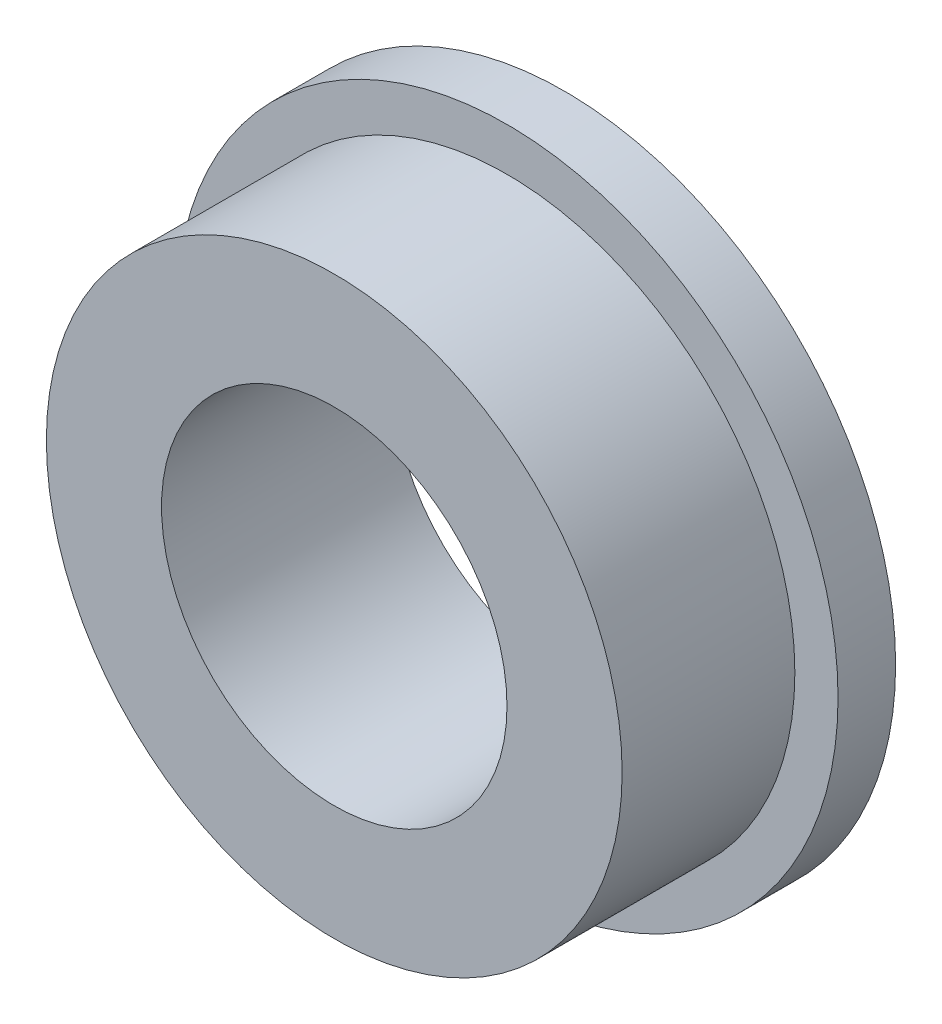
from build123d import *

# Parameters (mm, degrees)
SKETCH_1_R          = 5
SKETCH_1_R_2        = 3
EXTRUDE_1_DEPTH     = 4
SKETCH_2_R          = 5.75
EXTRUDE_2_DEPTH     = 0.9
SKETCH_3_R          = 3
CUT_EXTRUDE_2_DEPTH = 9.9
SKETCH_2_2_R        = 5.75
EXTRUDE_3_DEPTH     = 1
SKETCH_3_2_R        = 3
CUT_EXTRUDE_3_DEPTH = 7


with BuildPart() as part:
    # 草图1 → 凸台-拉伸1 (new body)
    with BuildSketch(Plane.XY):
        Circle(SKETCH_1_R)
        Circle(SKETCH_1_R_2, mode=Mode.SUBTRACT)
    extrude(amount=EXTRUDE_1_DEPTH)

    # 草图2 → 凸台-拉伸2 (add)
    with BuildSketch(Plane.XY):
        Circle(SKETCH_2_R)
    extrude(amount=EXTRUDE_2_DEPTH)

    # 草图3 → 切除-拉伸2 (cut)
    with BuildSketch(Plane.XY):
        Circle(SKETCH_3_R)
    extrude(amount=CUT_EXTRUDE_2_DEPTH, mode=Mode.SUBTRACT)

    # 草图2<2> → 凸台-拉伸3 (add)
    with BuildSketch(Plane.XY):
        Circle(SKETCH_2_2_R)
    extrude(amount=EXTRUDE_3_DEPTH)

    # 草图3<2> → 切除-拉伸3 (cut)
    with BuildSketch(Plane.XY):
        Circle(SKETCH_3_2_R)
    extrude(amount=CUT_EXTRUDE_3_DEPTH, mode=Mode.SUBTRACT)


solid = part.part
